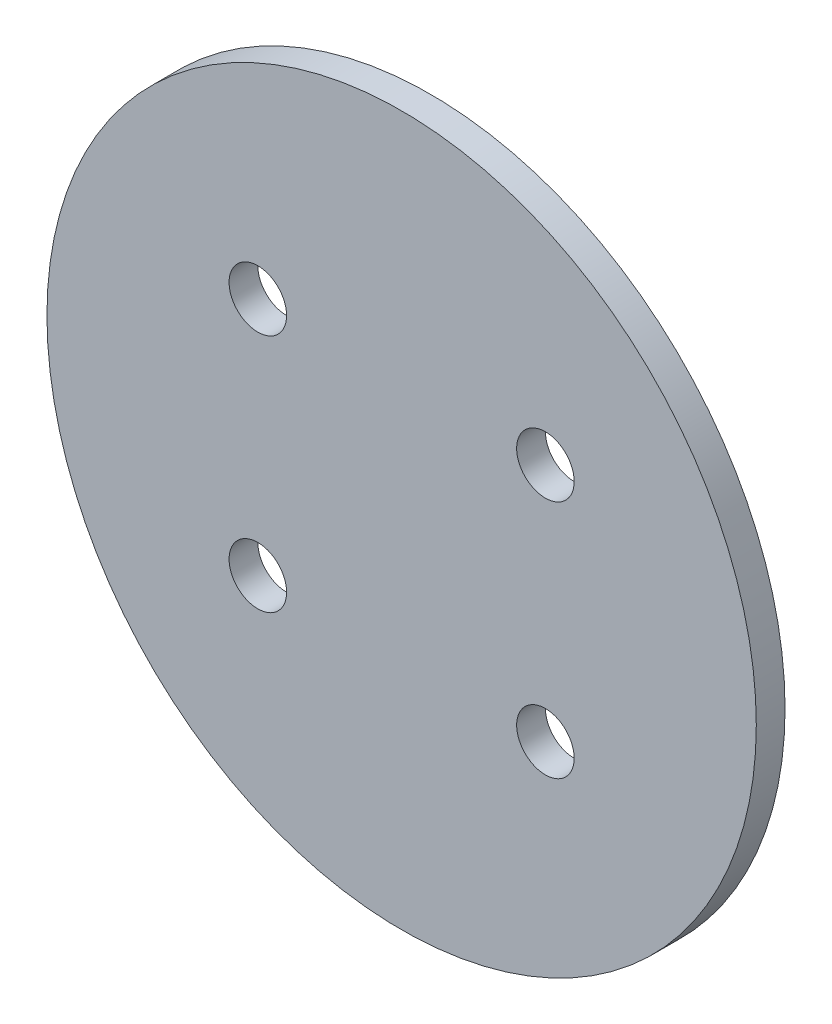
from build123d import *

# Parameters (mm, degrees)
MODEL_R             = 37
MODEL_R_2           = 3
BOSS_EXTRUDE1_DEPTH = 3


with BuildPart() as part:
    # Model → Boss-Extrude1 (new body)
    with BuildSketch(Plane.XY):
        Circle(MODEL_R)
        with Locations((-15, 12.5)):
            Circle(MODEL_R_2, mode=Mode.SUBTRACT)
        with Locations((-15, -12.5)):
            Circle(MODEL_R_2, mode=Mode.SUBTRACT)
        with Locations((15, -12.5)):
            Circle(MODEL_R_2, mode=Mode.SUBTRACT)
        with Locations((15, 12.5)):
            Circle(MODEL_R_2, mode=Mode.SUBTRACT)
    extrude(amount=BOSS_EXTRUDE1_DEPTH)


solid = part.part
